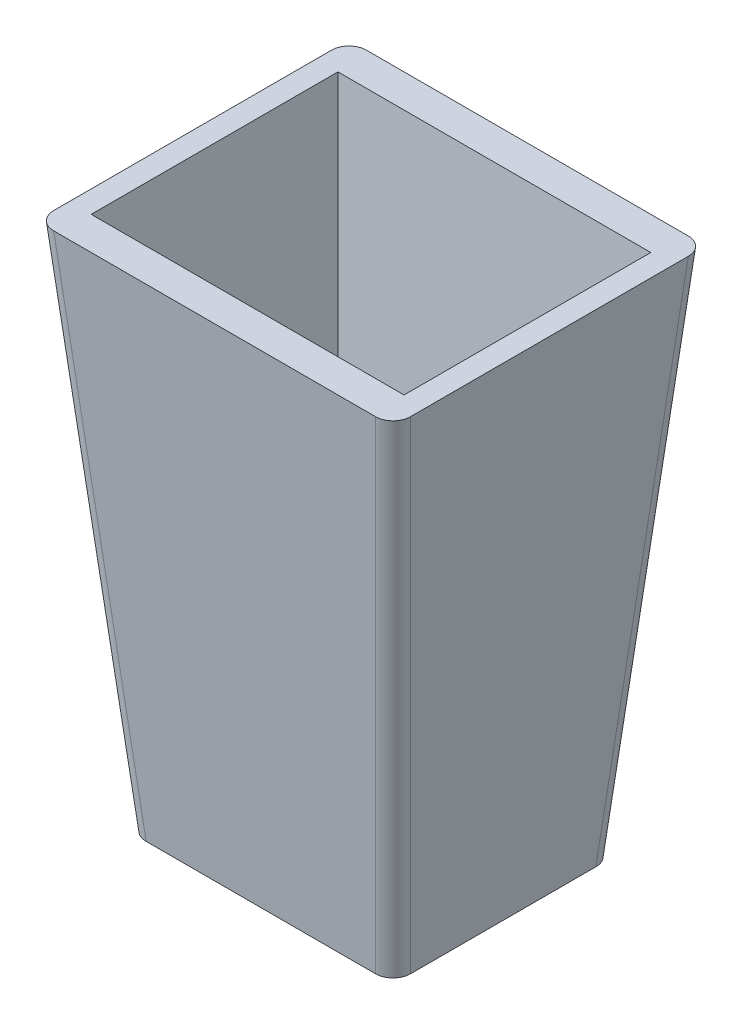
from build123d import *

# Parameters (mm, degrees)
SKETCH1_W           = 38.1
SKETCH1_H           = 31.75
BOSS_EXTRUDE1_DEPTH = 76.2
BOSS_EXTRUDE1_DRAFT = -5
SKETCH3_W           = 31.75
SKETCH3_H           = 22.225
CUT_EXTRUDE1_DEPTH  = 84.5219177
CUT_EXTRUDE1_DRAFT  = 5
FILLET1_R           = 2.54


with BuildPart() as part:
    # Sketch1 → Boss-Extrude1 (with draft: the straight prism first)
    with BuildSketch(Plane(origin=(0, 0, 0), x_dir=(1, 0, 0), z_dir=(0, 1, 0))):
        Rectangle(SKETCH1_W, SKETCH1_H)
    extrude(amount=BOSS_EXTRUDE1_DEPTH)
    # Boss-Extrude1: the draft: its side faces are tilted about the plane it starts from
    boss_extrude1_sides = [part.faces().sort_by_distance(p)[0] for p in [
        (0, 38.1, 15.875),
        (19.05, 38.1, 0),
        (0, 38.1, -15.875),
        (-19.05, 38.1, 0),
    ]]
    draft(boss_extrude1_sides, Plane(origin=(0, 0, 0), x_dir=(1, 0, 0), z_dir=(0, 1, 0)), BOSS_EXTRUDE1_DRAFT)


with BuildPart() as cut_extrude1_tool:
    # Sketch3 → Cut-Extrude1 (with draft: the straight prism first)
    with BuildSketch(Plane.XZ):
        Rectangle(SKETCH3_W, SKETCH3_H)
    extrude(amount=-CUT_EXTRUDE1_DEPTH)
    # Cut-Extrude1: the draft: its side faces are tilted about the plane it starts from
    cut_extrude1_sides = [cut_extrude1_tool.faces().sort_by_distance(p)[0] for p in [
        (0, 42.26095885, -11.1125),
        (15.875, 42.26095885, 0),
        (0, 42.26095885, 11.1125),
        (-15.875, 42.26095885, 0),
    ]]
    draft(cut_extrude1_sides, Plane.XZ, CUT_EXTRUDE1_DRAFT)


with BuildPart() as part_1:
    add(part.part)

    # Cut-Extrude1: cut by cut_extrude1_tool
    add(cut_extrude1_tool.part, mode=Mode.SUBTRACT)

    # Fillet1
    fillet1_edges = [part_1.edges().sort_by_distance(p)[0] for p in [
        (22.38331808, 38.1, 19.20831808),
        (-22.38331808, 38.1, 19.20831808),
        (-22.38331808, 38.1, -19.20831808),
        (22.38331808, 38.1, -19.20831808),
    ]]
    fillet(fillet1_edges, radius=FILLET1_R)


solid = part_1.part
